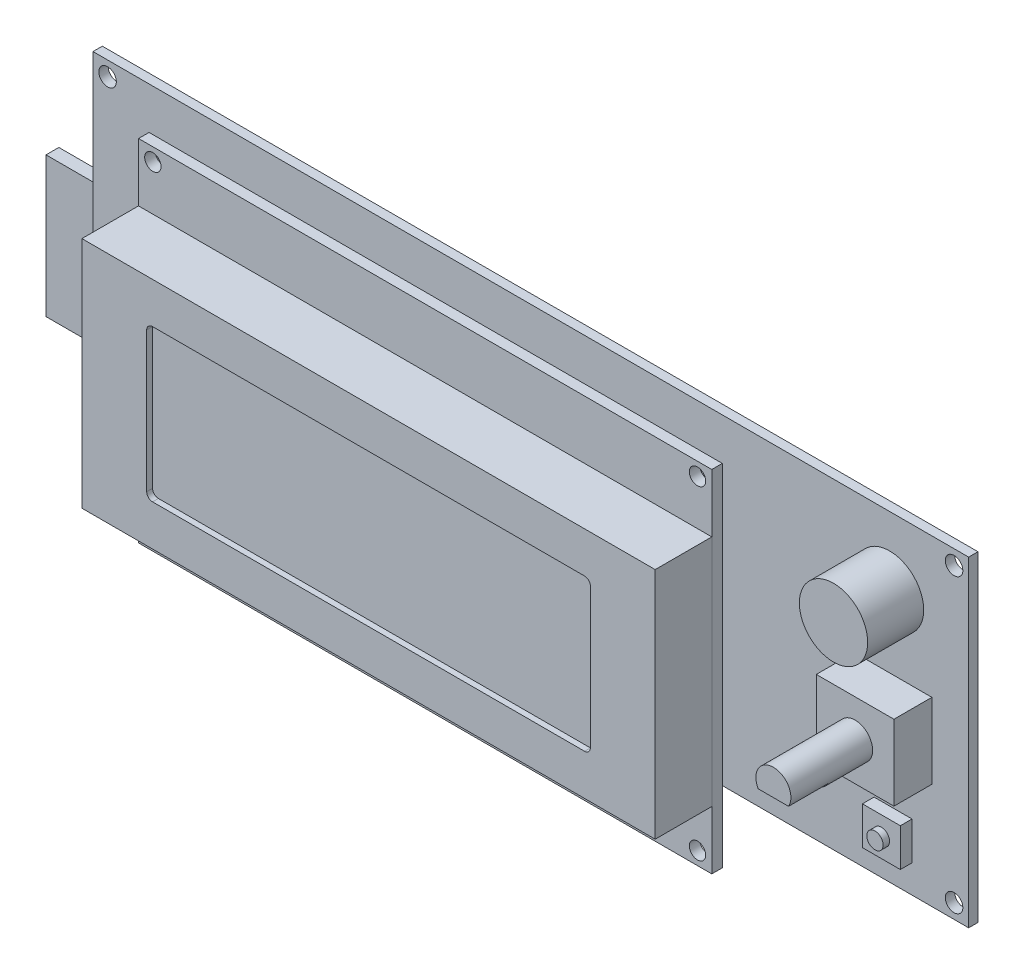
from build123d import *

# Parameters (mm, degrees)
SKETCH1_W                           = 150
SKETCH1_H                           = 55
PCB_DEPTH                           = 1.6
F_3_0_3_DIAMETER_HOLE1_D            = 3
F_3_0_3_DIAMETER_HOLE1_DEPTH        = 4
F_3_0_3_DIAMETER_HOLE1_TIP          = 0.901290929
SKETCH4_W                           = 20.3
SKETCH4_H                           = 8.8
IDC_CONN_DEPTH                      = 17.5
LPATTERN1_COUNT                     = 2
LPATTERN1_PITCH                     = 22.86
SKETCH5_W                           = 25.7
SKETCH5_H                           = 26.6
SD_SOCKET_DEPTH                     = 3.3
SKETCH6_W                           = 2.2
SKETCH6_H                           = 24
SD_CARD_DEPTH                       = 10.2
SKETCH7_R                           = 1.75
CONTRAST_POT_DEPTH                  = 2.5
EXTRUDE_2N3901_DEPTH                = 7
SKETCH9_W                           = 98.2
SKETCH9_H                           = 60
LCD_PCB_DEPTH                       = 1.8
SKETCH10_W                          = 98.2
SKETCH10_H                          = 40
LCD_HOUSING_DEPTH                   = 9.7
SKETCH11_W                          = 76
SKETCH11_H                          = 26
CUT_EXTRUDE1_DEPTH                  = 1
FILLET1_R                           = 1
F_2_8_2_8_DIAMETER_HOLE1_AT_2_COUNT = 2
F_2_8_2_8_DIAMETER_HOLE1_AT_2_PITCH = 93.3
F_2_8_2_8_DIAMETER_HOLE1_AT_3_COUNT = 2
F_2_8_2_8_DIAMETER_HOLE1_AT_3_PITCH = 108.55938467
F_2_8_2_8_DIAMETER_HOLE1_AT_4_COUNT = 2
F_2_8_2_8_DIAMETER_HOLE1_AT_4_PITCH = 55.5
SKETCH14_R                          = 5.85
BUZZER_DEPTH                        = 9.6
SKETCH15_W                          = 13.3
SKETCH15_H                          = 12.9
ENC_BODY_DEPTH                      = 6.5
SKETCH16_R                          = 3
ENC_SHAFT_DEPTH                     = 14
SKETCH17_W                          = 5.196152422
SKETCH17_H                          = 1.5
ENC_SHAFT_FLAT_DEPTH                = 6.8
SKETCH18_W                          = 6.5
SKETCH18_H                          = 6.5
E_STOP_SW_BODY_DEPTH                = 2
SKETCH19_R                          = 1.4
E_STOP_SW_BUTTON_DEPTH              = 1.1


with BuildPart() as part:
    # Sketch1 → PCB (new body)
    with BuildSketch(Plane.XY):
        Rectangle(SKETCH1_W, SKETCH1_H)
    extrude(amount=-PCB_DEPTH)

    # Ø3.0 (3) Diameter Hole1
    with Locations(Plane.XY):
        with Locations((-72.5, 25), (72.5, 25), (72.5, -25), (-72.5, -25)):
            Hole(F_3_0_3_DIAMETER_HOLE1_D / 2, depth=F_3_0_3_DIAMETER_HOLE1_DEPTH)
            with Locations((0, 0, -(F_3_0_3_DIAMETER_HOLE1_DEPTH + F_3_0_3_DIAMETER_HOLE1_TIP / 2))):  # 118° drill point
                Cone(0, F_3_0_3_DIAMETER_HOLE1_D / 2, F_3_0_3_DIAMETER_HOLE1_TIP, mode=Mode.SUBTRACT)

    # Sketch4 → IDC conn (add)
    with BuildSketch(Plane(origin=(0, 0, -1.6), x_dir=(-1, 0, 0), z_dir=(0, 0, -1))):
        with Locations((-4.05, 0.6)):
            Rectangle(SKETCH4_W, SKETCH4_H)
    idc_conn = extrude(amount=IDC_CONN_DEPTH)

    # LPattern1: IDC conn ×2
    with Locations(*[(-i * LPATTERN1_PITCH, 0, 0) for i in range(1, LPATTERN1_COUNT)]):
        add(idc_conn)



with BuildPart() as body_2:
    # Sketch5 → SD socket (new body)
    with BuildSketch(Plane(origin=(0, 0, -1.6), x_dir=(-1, 0, 0), z_dir=(0, 0, -1))):
        with Locations((62.15, -6)):
            Rectangle(SKETCH5_W, SKETCH5_H)
    extrude(amount=SD_SOCKET_DEPTH)


with BuildPart() as part_1:
    add(part.part)

    add(body_2.part)  # SD card merges body 2
    # Sketch6 → SD card (add)
    with BuildSketch(Plane.ZY.offset(75)):
        with Locations((-3.25, -6)):
            Rectangle(SKETCH6_W, SKETCH6_H)
    extrude(amount=SD_CARD_DEPTH)

    # Sketch7 → Contrast pot (add)
    with BuildSketch(Plane(origin=(0, 0, -1.6), x_dir=(-1, 0, 0), z_dir=(0, 0, -1))):
        with Locations((50.7, 13.1)):
            Circle(SKETCH7_R)
        Polygon((50.95, 12.85), (51.7, 12.85), (51.7, 13.35), (50.95, 13.35), (50.95, 14.1), (50.45, 14.1), (50.45, 13.35), (49.7, 13.35), (49.7, 12.85), (50.45, 12.85), (50.45, 12.1), (50.95, 12.1), align=None, mode=Mode.SUBTRACT)
    extrude(amount=CONTRAST_POT_DEPTH)

    # Sketch8 → 2N3901 (add)
    with BuildSketch(Plane(origin=(0, 0, -1.6), x_dir=(-1, 0, 0), z_dir=(0, 0, -1))):
        with BuildLine():
            Line((-3.8, 11.070683188), (-3.8, 14.729316812))
            ThreePointArc((-3.8, 14.729316812), (-7.56, 12.9), (-3.8, 11.070683188))
        make_face()
    extrude(amount=EXTRUDE_2N3901_DEPTH)

    # Sketch14 → buzzer (add)
    with BuildSketch(Plane.XY):
        with Locations(Location((61.45, 15.8, 0), (0, 0, 180))):
            Circle(SKETCH14_R)
    extrude(amount=BUZZER_DEPTH)

    # Sketch15 → enc body (add)
    with BuildSketch(Plane.XY):
        with Locations((62.05, -2.9)):
            Rectangle(SKETCH15_W, SKETCH15_H)
    extrude(amount=ENC_BODY_DEPTH)

    # Sketch16 → enc shaft (add)
    with BuildSketch(Plane.XY.offset(6.5)):
        with Locations(Location((62.05, -2.9, 0), (0, 0, 180))):
            Circle(SKETCH16_R)
    extrude(amount=ENC_SHAFT_DEPTH)

    # Sketch17 → enc shaft flat (cut)
    with BuildSketch(Plane.XY.offset(20.5)):
        with Locations((62.05, -5.15)):
            Rectangle(SKETCH17_W, SKETCH17_H)
    extrude(amount=-ENC_SHAFT_FLAT_DEPTH, mode=Mode.SUBTRACT)

    # Sketch18 → e-stop sw body (add)
    with BuildSketch(Plane.XY):
        with Locations((62.05, -19.45)):
            Rectangle(SKETCH18_W, SKETCH18_H)
    extrude(amount=E_STOP_SW_BODY_DEPTH)

    # Sketch19 → e-stop sw button (add)
    with BuildSketch(Plane.XY.offset(2)):
        with Locations(Location((62.05, -19.45, 0), (0, 0, 180))):
            Circle(SKETCH19_R)
    extrude(amount=E_STOP_SW_BUTTON_DEPTH)


with BuildPart() as body_2_2:
    # Sketch9 → LCD PCB (new body)
    with BuildSketch(Plane.XY.offset(4)):
        with Locations((-12.3, -5.7)):
            Rectangle(SKETCH9_W, SKETCH9_H)
    extrude(amount=LCD_PCB_DEPTH)

    # Sketch12 → Ø2.8 (2.8) Diameter Hole1 (revolve, cut)
    with BuildSketch(Plane(origin=(-58.95, 22.05, 5.8), x_dir=(0, -1, 0), z_dir=(1, 0, 0))):
        Polygon((0, 0), (0, 4.841204867), (1.4, 4), (1.4, 0), align=None)
    f_2_8_2_8_diameter_hole1 = revolve(axis=Axis((-58.95, 22.05, 12.15), (0, 0, -1)), mode=Mode.SUBTRACT)

    # Ø2.8 (2.8) Diameter Hole1 at 2: Ø2.8 (2.8) Diameter Hole1 ×2
    with Locations(*[(i * F_2_8_2_8_DIAMETER_HOLE1_AT_2_PITCH, 0, 0) for i in range(1, F_2_8_2_8_DIAMETER_HOLE1_AT_2_COUNT)]):
        add(f_2_8_2_8_diameter_hole1, mode=Mode.SUBTRACT)

    # Ø2.8 (2.8) Diameter Hole1 at 3: Ø2.8 (2.8) Diameter Hole1 ×2
    with Locations(*[Vector(0.8594374432328761, -0.5112409228234149, 0) * (i * F_2_8_2_8_DIAMETER_HOLE1_AT_3_PITCH) for i in range(1, F_2_8_2_8_DIAMETER_HOLE1_AT_3_COUNT)]):
        add(f_2_8_2_8_diameter_hole1, mode=Mode.SUBTRACT)

    # Ø2.8 (2.8) Diameter Hole1 at 4: Ø2.8 (2.8) Diameter Hole1 ×2
    with Locations(*[(0, -i * F_2_8_2_8_DIAMETER_HOLE1_AT_4_PITCH, 0) for i in range(1, F_2_8_2_8_DIAMETER_HOLE1_AT_4_COUNT)]):
        add(f_2_8_2_8_diameter_hole1, mode=Mode.SUBTRACT)


with BuildPart() as body_3:
    # Sketch10 → LCD housing (new body)
    with BuildSketch(Plane.XY.offset(5.8)):
        with Locations((-12.3, -5.7)):
            Rectangle(SKETCH10_W, SKETCH10_H)
    extrude(amount=LCD_HOUSING_DEPTH)

    # Sketch11 → Cut-Extrude1 (cut)
    with BuildSketch(Plane.XY.offset(15.5)):
        with Locations((-12.3, -5.7)):
            Rectangle(SKETCH11_W, SKETCH11_H)
    extrude(amount=-CUT_EXTRUDE1_DEPTH, mode=Mode.SUBTRACT)

    # Fillet1
    fillet1_edges = [body_3.edges().sort_by_distance(p)[0] for p in [
        (-50.3, -18.7, 15),
        (-50.3, 7.3, 15),
        (25.7, 7.3, 15),
        (25.7, -18.7, 15),
    ]]
    fillet(fillet1_edges, radius=FILLET1_R)


solid = Compound([part_1.part, body_2_2.part, body_3.part])
